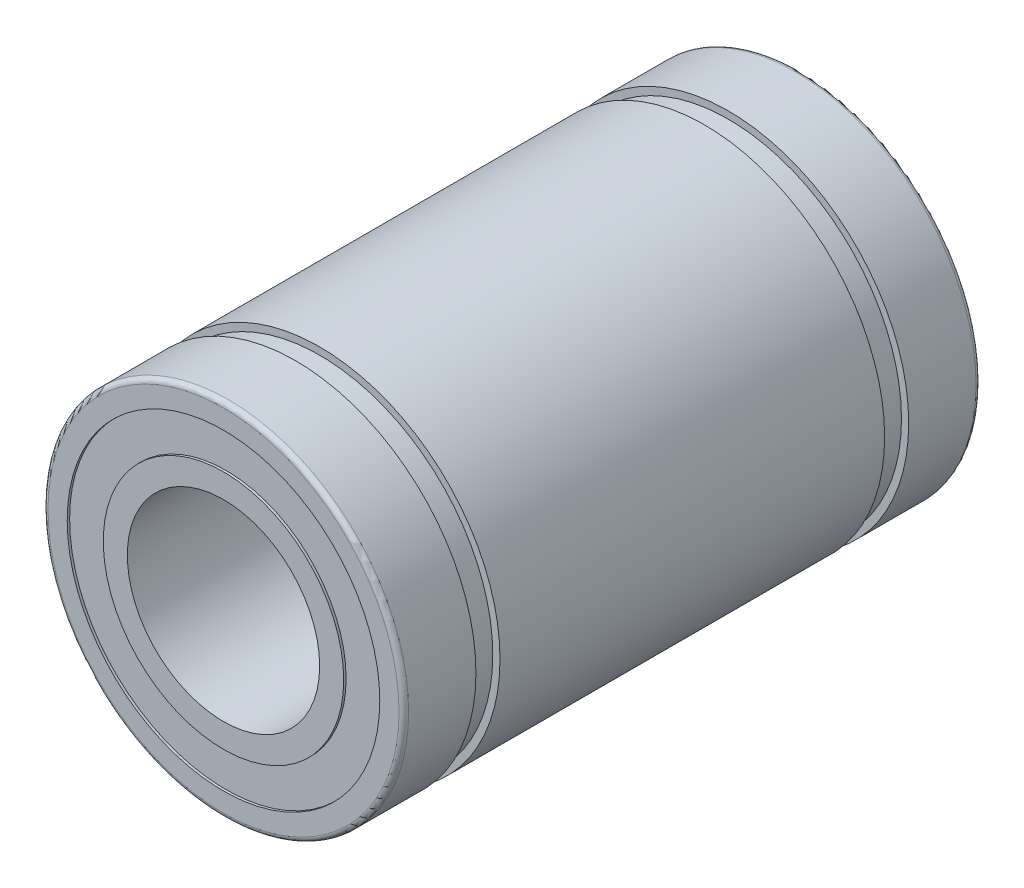
from build123d import *

# Parameters (mm, degrees)
FILLET1_R = 0.2


with BuildPart() as part:
    # Sketch1 → Revolve1 (revolve)
    with BuildSketch(Plane(origin=(0, 0, 0), x_dir=(0, 0, -1), z_dir=(1, 0, 0)), mode=Mode.PRIVATE) as revolve1_sk:
        Polygon((0, 7.5), (0, 6.5), (0.1, 6.5), (0.1, 5), (0, 5), (0, 4), (24, 4), (24, 5), (23.9, 5), (23.9, 6.5), (24, 6.5), (24, 7.5), (21, 7.5), (21, 7.2), (20, 7.2), (20, 7.5), (4, 7.5), (4, 7.2), (3, 7.2), (3, 7.5), align=None)
    revolve(revolve1_sk.sketch.rotate(Axis((0, 0, 0), (0, 0, -1)), 90), axis=Axis((0, 0, 0), (0, 0, -1)))

    # Fillet1
    fillet1_edges = [part.edges().sort_by_distance(p)[0] for p in [
        (-7.5, 0, -24),
        (-7.5, 0, 0),
    ]]
    fillet(fillet1_edges, radius=FILLET1_R)


solid = part.part
